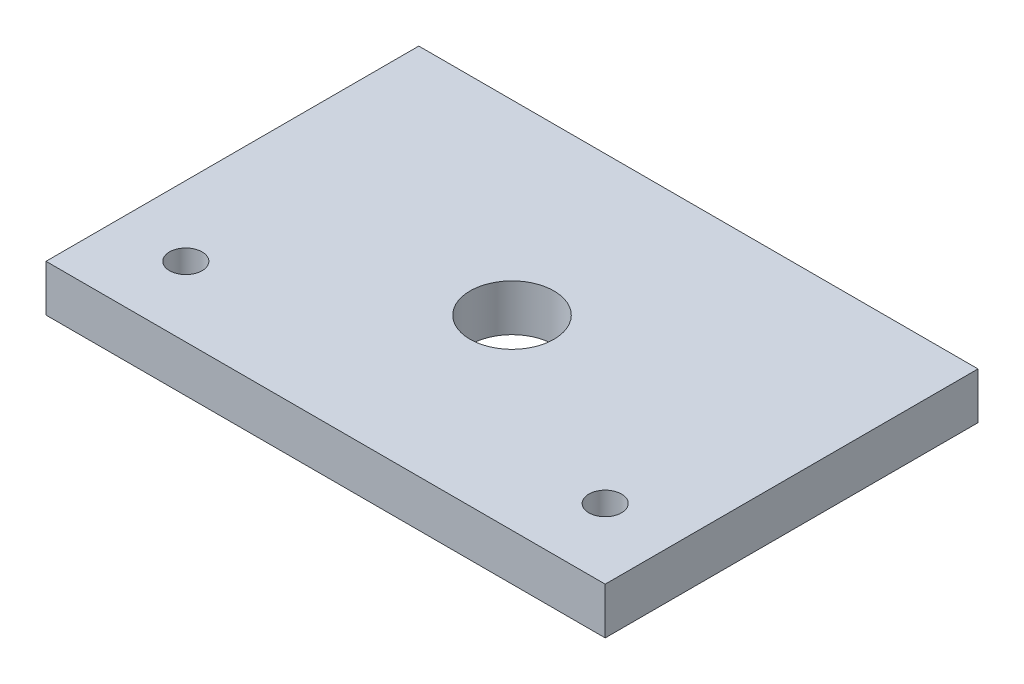
from build123d import *

# Parameters (mm, degrees)
SKETCH_1_W      = 120
SKETCH_1_H      = 80
SKETCH_1_R      = 9
SKETCH_1_R_2    = 3.5
EXTRUDE_1_DEPTH = 10


with BuildPart() as part:
    # 草图1 → 凸台-拉伸1 (new body)
    with BuildSketch(Plane(origin=(0, 0, 0), x_dir=(1, 0, 0), z_dir=(0, 1, 0))):
        Rectangle(SKETCH_1_W, SKETCH_1_H)
        with Locations(Location((0, 0, 0), (0, 0, 270))):
            Circle(SKETCH_1_R, mode=Mode.SUBTRACT)
        with Locations(Location((-45, -25, 0), (0, 0, 270))):
            Circle(SKETCH_1_R_2, mode=Mode.SUBTRACT)
        with Locations(Location((45, -25, 0), (0, 0, 270))):
            Circle(SKETCH_1_R_2, mode=Mode.SUBTRACT)
    extrude(amount=EXTRUDE_1_DEPTH)


solid = part.part
